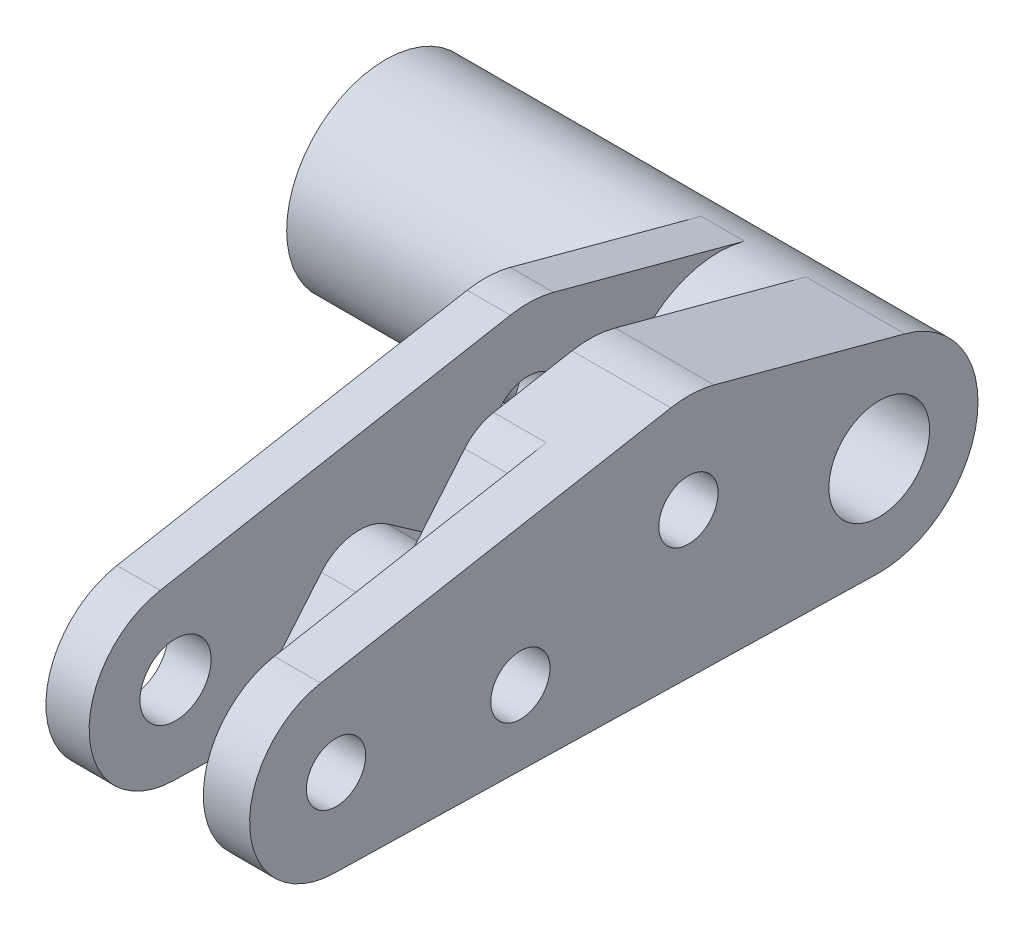
from build123d import *

# Parameters (mm, degrees)
BOSS_EXTRUDE1_DEPTH = 13.096874999999999
CUT_EXTRUDE4_START  = -6.35
CUT_EXTRUDE4_DEPTH  = 3.96875
CUT_EXTRUDE6_DEPTH  = 3.571875
SKETCH3_R           = 3.2385000000000006
SKETCH3_R_2         = 1.9049999999999998
SKETCH3_R_3         = 1.905
SKETCH3_R_4         = 1.9050000000000002
CUT_EXTRUDE2_DEPTH  = 44.62489589012807
SKETCH4_R           = 6.349999999999998
SKETCH4_R_2         = 3.2385000000000006
BOSS_EXTRUDE2_DEPTH = 18.653125
SKETCH5_R           = 2.286
SKETCH5_R_2         = 2.285999999999998
SKETCH5_R_3         = 2.2859999999999947
CUT_EXTRUDE5_DEPTH  = 2.778125
FILLET1_R           = 3.175


with BuildPart() as part:
    # Sketch1 → Boss-Extrude1 (new body)
    with BuildSketch(Plane(origin=(0, 0, 0), x_dir=(0, 0, -1), z_dir=(1, 0, 0))):
        with BuildLine():
            Line((-0.144318181818181, -6.348359808832252), (-35.051278409090905, -5.55481483272822))
            ThreePointArc((-35.051278409090905, -5.55481483272822), (-40.46435346310375, -0.4329864585648121), (-35.912861193635386, 5.467727528380438))
            Line((-35.912861193635386, 5.467727528380438), (-13.396242215168781, 9.535833333808146))
            ThreePointArc((-13.396242215168781, 9.535833333808146), (-12.00362991406523, 9.631527090305429), (-10.623757057470224, 9.420630869737527))
            Line((-10.623757057470224, 9.420630869737527), (1.643500936400966, 6.133628996935595))
            ThreePointArc((1.643500936400966, 6.133628996935595), (6.285849057186948, -0.9003341769931446), (-0.144318181818181, -6.348359808832252))
        make_face()
    extrude(amount=-BOSS_EXTRUDE1_DEPTH)

    # Sketch6 → Cut-Extrude4 (cut)
    with BuildSketch(Plane(origin=(0, 0, 0), x_dir=(0, 0, -1), z_dir=(1, 0, 0)).offset(CUT_EXTRUDE4_START)):
        with BuildLine():
            Line((1.643500936400966, 6.133628996935595), (-10.623757057470224, 9.420630869737526))
            ThreePointArc((-10.623757057470224, 9.420630869737526), (-12.00362991406523, 9.63152709030543), (-13.396242215168781, 9.535833333808146))
            Line((-13.396242215168781, 9.535833333808146), (-35.912861193635386, 5.467727528380437))
            ThreePointArc((-35.912861193635386, 5.467727528380437), (-40.46435346310375, -0.4329864585648108), (-35.051278409090905, -5.55481483272822))
            Line((-35.051278409090905, -5.55481483272822), (-31.977891932173424, -5.6246825720703155))
            ThreePointArc((-31.977891932173424, -5.6246825720703155), (-30.943788765977928, -4.9469644338822985), (-30.060617786194513, -4.081701321509548))
            Line((-30.060617786194513, -4.081701321509548), (-23.677913080624045, 3.524909941821936))
            Line((-23.677913080624045, 3.524909941821936), (-15.9094683647003, -1.9146136084331862))
            ThreePointArc((-15.9094683647003, -1.9146136084331862), (-10.095430083753156, -2.6800462691885727), (-6.133628996935595, 1.643500936400966))
            ThreePointArc((-6.133628996935595, 1.643500936400966), (-3.1750000000000385, 5.4992613140311635), (1.643500936400966, 6.133628996935595))
        make_face()
    extrude(amount=-CUT_EXTRUDE4_DEPTH, mode=Mode.SUBTRACT)

    # Sketch7 → Cut-Extrude6 (cut, symmetric)
    with BuildSketch(Plane(origin=(-6.5484374999999995, 0, 0), x_dir=(0, 0, -1), z_dir=(1, 0, 0))):
        with BuildLine():
            Line((-30.06061778619451, -4.0817013215095495), (-19.57011605971736, 8.420391799135219))
            Line((-19.57011605971736, 8.420391799135219), (-35.912861193635386, 5.467727528380437))
            ThreePointArc((-35.912861193635386, 5.467727528380437), (-40.46435346310375, -0.4329864585648108), (-35.051278409090905, -5.55481483272822))
            Line((-35.051278409090905, -5.55481483272822), (-31.977891932173424, -5.6246825720703155))
            ThreePointArc((-31.977891932173424, -5.6246825720703155), (-30.943788765977924, -4.946964433882303), (-30.06061778619451, -4.0817013215095495))
        make_face()
    extrude(amount=CUT_EXTRUDE6_DEPTH, both=True, mode=Mode.SUBTRACT)

    # Sketch3 → Cut-Extrude2 (cut, through all)
    with BuildSketch(Plane(origin=(0, 0, 0), x_dir=(0, 0, -1), z_dir=(1, 0, 0))):
        Circle(SKETCH3_R)
        with Locations((-34.925, 0)):
            Circle(SKETCH3_R_2)
        with Locations((-12.26725799387119, 3.287001872801932)):
            Circle(SKETCH3_R_3)
        with Locations((-23.07385471451217, -1.0633688768983705)):
            Circle(SKETCH3_R_4)
    extrude(amount=-CUT_EXTRUDE2_DEPTH, mode=Mode.SUBTRACT)

    # Sketch4 → Boss-Extrude2 (add)
    with BuildSketch(Plane.ZY.offset(13.096874999999999)):
        with Locations(Location((0, 0, 0), (0, 0, 180))):
            Circle(SKETCH4_R)
        with Locations(Location((0, 0, 0), (0, 0, 180))):
            Circle(SKETCH4_R_2, mode=Mode.SUBTRACT)
    extrude(amount=BOSS_EXTRUDE2_DEPTH)

    # Sketch5 → Cut-Extrude5 (cut)
    with BuildSketch(Plane.ZY.offset(13.096874999999999)):
        with Locations((12.26725799387119, 3.287001872801932)):
            Circle(SKETCH5_R)
        with Locations((23.07385471451217, -1.0633688768983705)):
            Circle(SKETCH5_R_2)
        with Locations((34.925, 0)):
            Circle(SKETCH5_R_3)
    extrude(amount=-CUT_EXTRUDE5_DEPTH, mode=Mode.SUBTRACT)

    # Fillet1
    fillet1_edges = [part.edges().sort_by_distance(p)[0] for p in [
        (-8.334375, 3.524909941821936, 23.677913080624045),
        (-4.66328125, 8.420391799135219, 19.57011605971736),
    ]]
    fillet(fillet1_edges, radius=FILLET1_R)


solid = part.part
